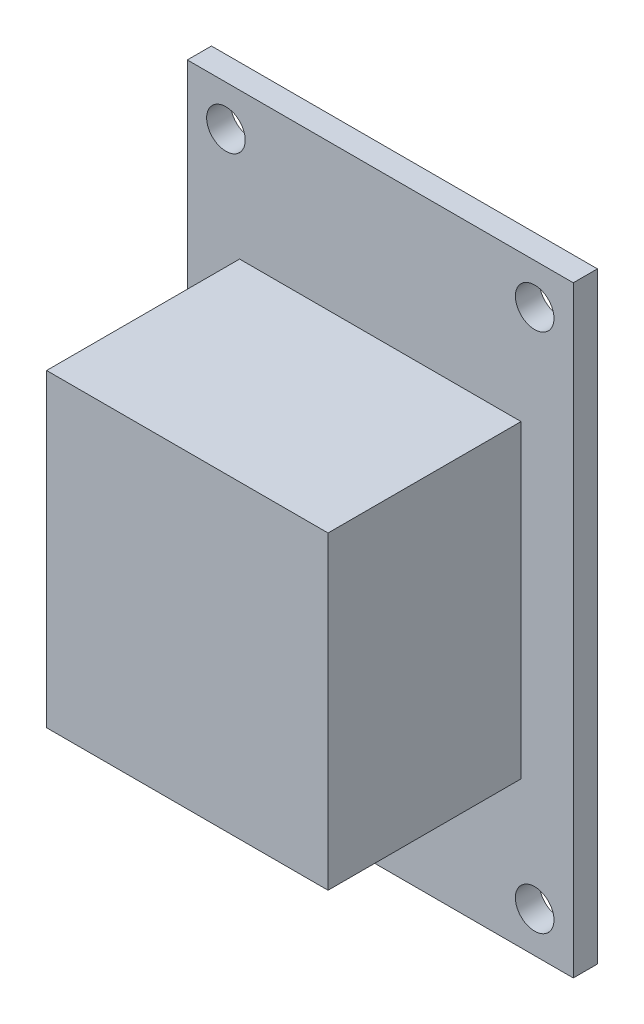
from build123d import *

# Parameters (mm, degrees)
SKETCH1_W           = 25.4
SKETCH1_H           = 39.624
BOSS_EXTRUDE1_DEPTH = 1.5875
SKETCH2_W           = 18.522507708
SKETCH2_H           = 20.364234326
BOSS_EXTRUDE2_DEPTH = 12.7
SKETCH3_R           = 1.27
CUT_EXTRUDE1_DEPTH  = 27.741266687


with BuildPart() as part:
    # Sketch1 → Boss-Extrude1 (new body)
    with BuildSketch(Plane.XY):
        Rectangle(SKETCH1_W, SKETCH1_H)
    extrude(amount=BOSS_EXTRUDE1_DEPTH)

    # Sketch2 → Boss-Extrude2 (add)
    with BuildSketch(Plane.XY.offset(1.5875)):
        Rectangle(SKETCH2_W, SKETCH2_H)
    extrude(amount=BOSS_EXTRUDE2_DEPTH)

    # Sketch3 → Cut-Extrude1 (cut, through all)
    with BuildSketch(Plane.XY.offset(1.5875)):
        with Locations((-10.16, 17.145)):
            Circle(SKETCH3_R)
        with Locations((10.16, 17.145)):
            Circle(SKETCH3_R)
        with Locations((10.16, -17.145)):
            Circle(SKETCH3_R)
        with Locations((-10.16, -17.145)):
            Circle(SKETCH3_R)
    extrude(amount=-CUT_EXTRUDE1_DEPTH, mode=Mode.SUBTRACT)


solid = part.part
